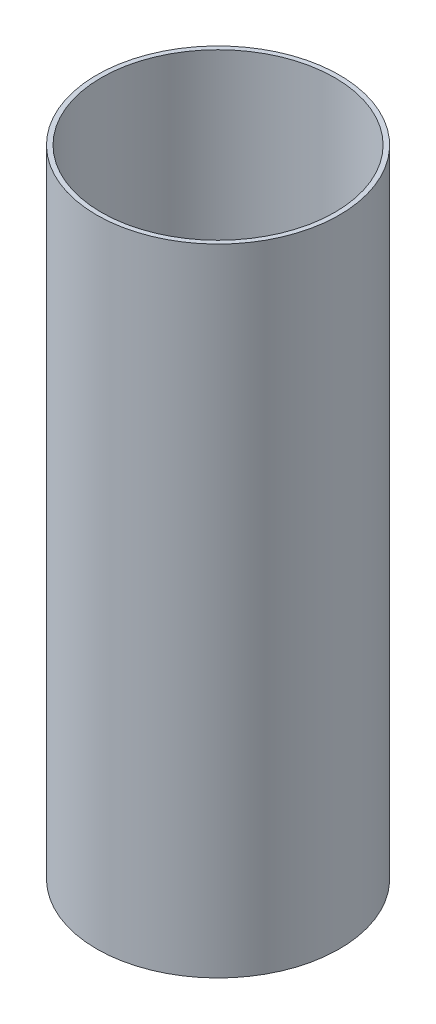
from build123d import *

# Parameters (mm, degrees)
SKETCH_1_R      = 52.5
SKETCH_1_R_2    = 50.5
EXTRUDE_1_DEPTH = 275


with BuildPart() as part:
    # Эскиз1 → Бобышка-Вытянуть1 (new body)
    with BuildSketch(Plane(origin=(0, 0, 0), x_dir=(1, 0, 0), z_dir=(0, 1, 0))):
        with Locations(Location((0, 0, 0), (0, 0, 270))):
            Circle(SKETCH_1_R)
        with Locations(Location((0, 0, 0), (0, 0, 270))):
            Circle(SKETCH_1_R_2, mode=Mode.SUBTRACT)
    extrude(amount=EXTRUDE_1_DEPTH)


solid = part.part
